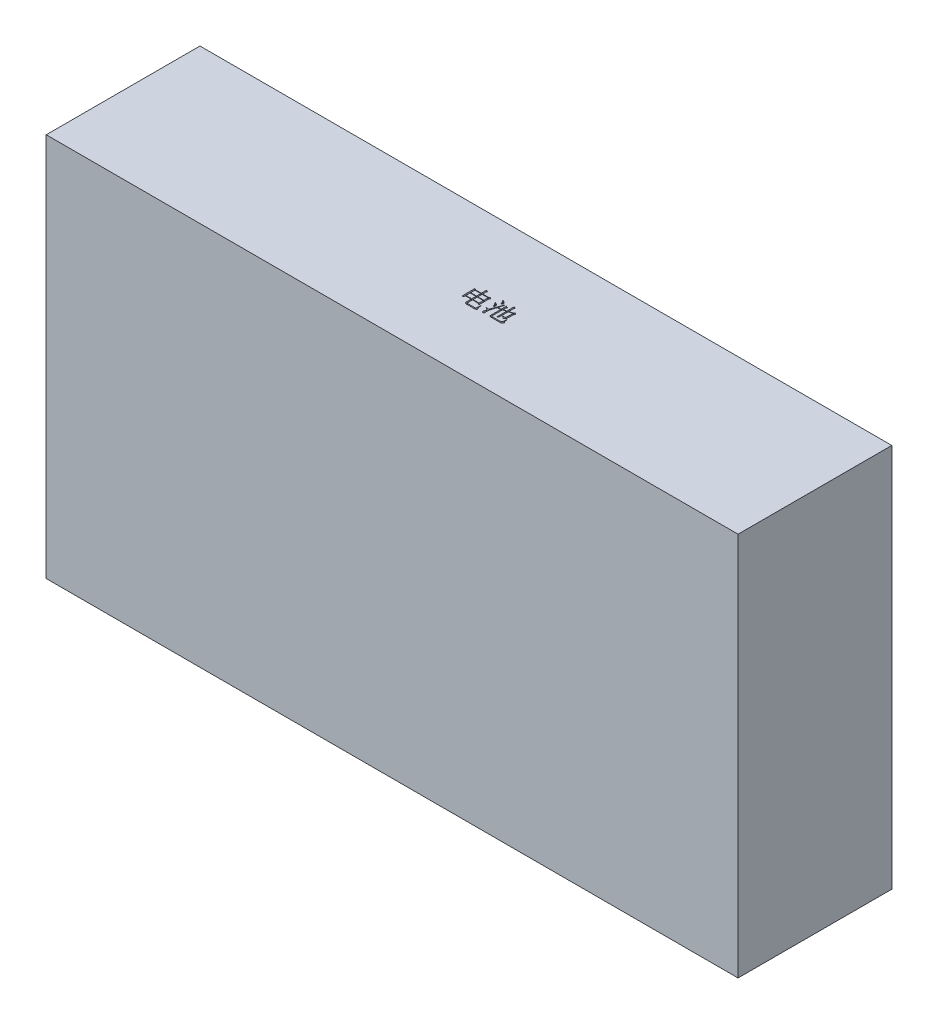
from build123d import *

# Parameters (mm, degrees)
SKETCH_1_W          = 135
SKETCH_1_H          = 75
EXTRUDE_1_DEPTH     = 30
SKETCH_2_W          = 1.135817308
SKETCH_2_H          = 0.828725962
SKETCH_2_W_2        = 1.173677885
CUT_EXTRUDE_1_DEPTH = 2
SKETCH_3_W          = 1.135817308
SKETCH_3_H          = 0.828725961
SKETCH_3_W_2        = 1.173677885
SKETCH_3_H_2        = 0.828725962
CUT_EXTRUDE_2_DEPTH = 2


with BuildPart() as part:
    # 草图1 → 凸台-拉伸1 (new body)
    with BuildSketch(Plane.XY):
        Rectangle(SKETCH_1_W, SKETCH_1_H)
    extrude(amount=EXTRUDE_1_DEPTH)

    # 草图2 → 切除-拉伸1 (cut)
    # profile 1 of 5: a face of its own
    with BuildSketch(Plane(origin=(0, 0, 0), x_dir=(-1, 0, 0), z_dir=(0, 0, -1))):
        with BuildLine():
            add(Edge.make_bspline(
                [(-1.518096579, -12.00005887), (-1.51839648, -11.910080093), (-1.518983063, -11.734088851), (-1.522662, -11.476069715), (-1.527771012, -11.229940253), (-1.533992651, -11.069896883), (-1.537026867, -10.991845729)],
                knots=[0, 0, 0, 0, 1.070688816, 2.094181113, 3.070555925, 4, 4, 4, 4], degree=3))
            Line((-1.537026867, -10.991845729), (-1.101630233, -11.200780024))
            Line((-1.101630233, -11.200780024), (-1.253072541, -11.333993165))
            Line((-1.253072541, -11.333993165), (-1.253072541, -12.00005887))
            Line((-1.253072541, -12.00005887), (-0.098324944, -12.00005887))
            Line((-0.098324944, -12.00005887), (0.09097794, -11.810755986))
            Line((0.09097794, -11.810755986), (0.356001979, -12.075780024))
            Line((0.356001979, -12.075780024), (0.185629383, -12.207590922))
            add(Edge.make_bspline(
                [(0.185629383, -12.207590922), (0.185648727, -12.269055892), (0.185686459, -12.388947641), (0.185418819, -12.564229137), (0.18635867, -12.730627775), (0.187004406, -12.888146551), (0.187694801, -13.036784555), (0.188474293, -13.176540829), (0.188898989, -13.307654935), (0.190526705, -13.430113938), (0.191876796, -13.543696055), (0.193259336, -13.648163825), (0.194745866, -13.743748333), (0.195860051, -13.830698919), (0.198144027, -13.908749475), (0.200217449, -13.977927681), (0.202279662, -14.038226668), (0.203838586, -14.075613868), (0.204559671, -14.092907428)],
                knots=[0, 0, 0, 0, 1.564731616, 3.052119083, 4.462174954, 5.800836896, 7.0621555, 8.246130873, 9.358712606, 10.399951826, 11.363852354, 12.25041514, 13.059641411, 13.79748155, 14.464070136, 15.047399153, 15.559371661, 16, 16, 16, 16], degree=3))
            Line((0.204559671, -14.092907428), (-0.079394656, -14.225419447))
            Line((-0.079394656, -14.225419447), (-0.079394656, -13.998255986))
            Line((-0.079394656, -13.998255986), (-1.253072541, -13.998255986))
            Line((-1.253072541, -13.998255986), (-1.253072541, -14.861336915))
            add(Edge.make_bspline(
                [(-1.253072541, -14.861336915), (-1.252464781, -14.877976301), (-1.251320635, -14.909301), (-1.241178206, -14.953307775), (-1.222084156, -14.98992959), (-1.197451788, -15.021395208), (-1.164087627, -15.044618517), (-1.124115458, -15.060909186), (-1.077302267, -15.070506817), (-1.043717894, -15.071727358), (-1.025909079, -15.072374575)],
                knots=[0, 0, 0, 0, 1.124103962, 2.116197056, 3.020287974, 3.895928428, 4.79003215, 5.731558757, 6.79711165, 8, 8, 8, 8], degree=3))
            Line((-1.025909079, -15.072374575), (0.280280825, -15.072374575))
            add(Edge.make_bspline(
                [(0.280280825, -15.072374575), (0.293717118, -15.070525707), (0.319710379, -15.066948967), (0.355471541, -15.053835763), (0.387380473, -15.037236078), (0.413716528, -15.014212803), (0.434996481, -14.986137644), (0.452168119, -14.953311636), (0.463782067, -14.915262305), (0.470397958, -14.871329778), (0.474846547, -14.819535416), (0.48006715, -14.757163679), (0.483624174, -14.683004748), (0.488928062, -14.597504339), (0.493604465, -14.500735356), (0.498816059, -14.392549057), (0.502510982, -14.272618552), (0.505748704, -14.188725116), (0.507444286, -14.144790441)],
                knots=[0, 0, 0, 0, 0.629422311, 1.217652751, 1.762775589, 2.294829829, 2.829987746, 3.394303386, 4.0100451, 4.671629752, 5.458421737, 6.429409418, 7.584151651, 8.913252979, 10.416123777, 12.092816459, 13.95382277, 16, 16, 16, 16], degree=3))
            Line((0.507444286, -14.144790441), (0.602095729, -14.144790441))
            add(Edge.make_bspline(
                [(0.602095729, -14.144790441), (0.602059878, -14.182656597), (0.601991477, -14.254901998), (0.606105707, -14.358190303), (0.610163764, -14.451323399), (0.618330455, -14.534260478), (0.626932994, -14.607331833), (0.638057053, -14.670550676), (0.650747867, -14.723975171), (0.671399828, -14.780989378), (0.703342799, -14.842369491), (0.749876219, -14.907452208), (0.803734922, -14.966663139), (0.845787304, -14.999119266), (0.867119767, -15.01558371)],
                knots=[0, 0, 0, 0, 1.432623561, 2.73332378, 3.91109551, 4.959115756, 5.885964426, 6.694330385, 7.387096859, 7.960541899, 8.984902095, 9.993374407, 10.982072752, 12, 12, 12, 12], degree=3))
            add(Edge.make_bspline(
                [(0.867119767, -15.01558371), (0.854367876, -15.03929637), (0.829739692, -15.085093476), (0.784835912, -15.145888343), (0.734473187, -15.195833018), (0.678402183, -15.235817856), (0.613265116, -15.265450339), (0.537577604, -15.28471715), (0.450621244, -15.2976005), (0.388774926, -15.298866939), (0.356001979, -15.299538037)],
                knots=[0, 0, 0, 0, 1.033786579, 1.996588944, 2.892065822, 3.749251075, 4.629327101, 5.624996779, 6.741463396, 8, 8, 8, 8], degree=3))
            Line((0.356001979, -15.299538037), (-1.120560521, -15.299538037))
            add(Edge.make_bspline(
                [(-1.120560521, -15.299538037), (-1.151732325, -15.298361407), (-1.210423792, -15.296146004), (-1.29279433, -15.278927441), (-1.36306229, -15.249084058), (-1.420258983, -15.205638404), (-1.465249991, -15.150540049), (-1.496967017, -15.083011936), (-1.514809153, -15.003403106), (-1.516958457, -14.946733706), (-1.518096579, -14.916725537)],
                knots=[0, 0, 0, 0, 1.182522994, 2.2264996, 3.175847754, 4.055853476, 4.925921917, 5.850408872, 6.861726179, 8, 8, 8, 8], degree=3))
            Line((-1.518096579, -14.916725537), (-1.518096579, -13.998255986))
            Line((-1.518096579, -13.998255986), (-2.653913887, -13.998255986))
            Line((-2.653913887, -13.998255986), (-2.653913887, -14.263280024))
            Line((-2.653913887, -14.263280024), (-2.937868214, -14.395792043))
            add(Edge.make_bspline(
                [(-2.937868214, -14.395792043), (-2.932567229, -14.178455719), (-2.92182957, -13.738219927), (-2.918047586, -13.187061219), (-2.919931588, -12.747212345), (-2.923481317, -12.428897495), (-2.928628177, -12.124582157), (-2.934836752, -11.926435397), (-2.937868214, -11.829686274)],
                knots=[0, 0, 0, 0, 1.524726016, 3.088480342, 3.86542604, 4.609627723, 5.321122896, 6, 6, 6, 6], degree=3))
            Line((-2.937868214, -11.829686274), (-2.634983598, -12.00005887))
            Line((-2.634983598, -12.00005887), (-1.518096579, -12.00005887))
        make_face()
        with Locations((-2.086005233, -12.528003582)):
            Rectangle(SKETCH_2_W, SKETCH_2_H, mode=Mode.SUBTRACT)
        with Locations((-0.666233599, -12.528003582)):
            Rectangle(SKETCH_2_W_2, SKETCH_2_H, mode=Mode.SUBTRACT)
        with Locations((-2.086005233, -13.470311274)):
            Rectangle(SKETCH_2_W, SKETCH_2_H, mode=Mode.SUBTRACT)
        with Locations((-0.666233599, -13.470311274)):
            Rectangle(SKETCH_2_W_2, SKETCH_2_H, mode=Mode.SUBTRACT)
    # profile 2 of 5: a face of its own
    with BuildSketch(Plane(origin=(0, 0, 0), x_dir=(-1, 0, 0), z_dir=(0, 0, -1))):
        with BuildLine():
            Line((3.990617363, -12.602322492), (3.365917844, -12.752362556))
            Line((3.365917844, -12.752362556), (3.365917844, -14.629966723))
            add(Edge.make_bspline(
                [(3.365917844, -14.629966723), (3.366286239, -14.650583705), (3.366977081, -14.689246238), (3.376400483, -14.743139062), (3.390126047, -14.789458544), (3.411890521, -14.8268035), (3.438367838, -14.85722321), (3.47213071, -14.878613181), (3.512142811, -14.890583803), (3.540415547, -14.892095688), (3.555220729, -14.892887396)],
                knots=[0, 0, 0, 0, 1.341381956, 2.515461521, 3.555606715, 4.469749405, 5.310702008, 6.159749455, 7.036342158, 8, 8, 8, 8], degree=3))
            Line((3.555220729, -14.892887396), (5.126434671, -14.892887396))
            add(Edge.make_bspline(
                [(5.126434671, -14.892887396), (5.142849761, -14.892262013), (5.174412817, -14.891059521), (5.219518965, -14.880525948), (5.259024016, -14.86224176), (5.293438162, -14.836917189), (5.321329727, -14.803901604), (5.345095171, -14.764593656), (5.362337227, -14.717687311), (5.373462595, -14.663713151), (5.38220211, -14.603461722), (5.389969971, -14.536823465), (5.395861844, -14.463836448), (5.402071849, -14.38442237), (5.404588711, -14.298327135), (5.40898133, -14.205826583), (5.409721578, -14.106695436), (5.410161509, -14.038452506), (5.410388998, -14.003163838)],
                knots=[0, 0, 0, 0, 0.7605698, 1.462429284, 2.131562217, 2.766653432, 3.427307041, 4.122440357, 4.887321986, 5.731339313, 6.673967508, 7.71042515, 8.841755492, 10.069477544, 11.403612001, 12.835210489, 14.363475806, 16, 16, 16, 16], degree=3))
            Line((5.410388998, -14.003163838), (5.50504044, -14.003163838))
            add(Edge.make_bspline(
                [(5.50504044, -14.003163838), (5.506832948, -14.037756804), (5.510261753, -14.103928107), (5.516384788, -14.198621728), (5.523883087, -14.28397889), (5.533113873, -14.359687471), (5.542615038, -14.425950999), (5.553636244, -14.482872416), (5.565996867, -14.53044431), (5.583517333, -14.581341723), (5.61238666, -14.636147181), (5.655894312, -14.695345371), (5.707890347, -14.750971066), (5.748994832, -14.78221877), (5.770064479, -14.798235954)],
                knots=[0, 0, 0, 0, 1.426525458, 2.728735367, 3.907704043, 4.954667923, 5.869362767, 6.664021964, 7.341038244, 7.89200131, 8.87776317, 9.876918957, 10.911735073, 12, 12, 12, 12], degree=3))
            add(Edge.make_bspline(
                [(5.770064479, -14.798235954), (5.756965551, -14.825021617), (5.731550843, -14.876991502), (5.683061774, -14.946670166), (5.625970037, -15.003847882), (5.563097529, -15.051522258), (5.491882592, -15.085790489), (5.414034705, -15.108918528), (5.329265469, -15.122086887), (5.270441776, -15.120744948), (5.240016402, -15.120050857)],
                knots=[0, 0, 0, 0, 1.075096548, 2.085916022, 3.046068131, 3.980541465, 4.919722121, 5.880207532, 6.903579907, 8, 8, 8, 8], degree=3))
            Line((5.240016402, -15.120050857), (3.479499575, -15.120050857))
            add(Edge.make_bspline(
                [(3.479499575, -15.120050857), (3.451340682, -15.118943016), (3.398096789, -15.116848269), (3.323377374, -15.098502635), (3.259220936, -15.067783178), (3.207229371, -15.02270441), (3.16692845, -14.965441824), (3.13930916, -14.895827004), (3.122461642, -14.814457768), (3.120739607, -14.756259929), (3.119824094, -14.725319287)],
                knots=[0, 0, 0, 0, 1.103584427, 2.086698913, 2.997196219, 3.868565132, 4.756616822, 5.718849767, 6.787235826, 8, 8, 8, 8], degree=3))
            Line((3.119824094, -14.725319287), (3.119824094, -12.809854543))
            Line((3.119824094, -12.809854543), (2.79800919, -12.884874575))
            Line((2.79800919, -12.884874575), (2.722288036, -12.959894607))
            Line((2.722288036, -12.959894607), (2.589776017, -12.828784832))
            Line((2.589776017, -12.828784832), (3.119824094, -12.715904223))
            add(Edge.make_bspline(
                [(3.119824094, -12.715904223), (3.119967872, -12.657476785), (3.120243357, -12.545527773), (3.118370047, -12.38520839), (3.11725181, -12.24007134), (3.115274214, -12.110355511), (3.112140675, -11.996086677), (3.109966143, -11.896951169), (3.105521049, -11.813068176), (3.102329176, -11.762142568), (3.100893806, -11.739241563)],
                knots=[0, 0, 0, 0, 1.435253637, 2.749996107, 3.938441586, 5.000668915, 5.936736011, 6.746544728, 7.436327089, 8, 8, 8, 8], degree=3))
            Line((3.100893806, -11.739241563), (3.498429863, -11.94537137))
            Line((3.498429863, -11.94537137), (3.365917844, -12.058251979))
            Line((3.365917844, -12.058251979), (3.365917844, -12.659113357))
            Line((3.365917844, -12.659113357), (3.990617363, -12.509073293))
            add(Edge.make_bspline(
                [(3.990617363, -12.509073293), (3.99059817, -12.463967845), (3.990560578, -12.375626605), (3.990828715, -12.246385066), (3.989885763, -12.12322262), (3.989241221, -12.006368873), (3.9885501, -11.895591393), (3.98777028, -11.790891426), (3.987347269, -11.692261217), (3.985722606, -11.599951578), (3.984359283, -11.513947006), (3.982970855, -11.434018476), (3.981509463, -11.360168774), (3.980374343, -11.292379411), (3.978070182, -11.23092522), (3.976022706, -11.175534669), (3.973951009, -11.126453632), (3.972406422, -11.095844594), (3.971687075, -11.081589319)],
                knots=[0, 0, 0, 0, 1.516438171, 2.970018801, 4.345049955, 5.657224643, 6.898685937, 8.069434, 9.177326018, 10.214594483, 11.173300777, 12.069158568, 12.902169219, 13.656623382, 14.348458002, 14.969623617, 15.520131973, 16, 16, 16, 16], degree=3))
            Line((3.971687075, -11.081589319), (4.388153421, -11.26948996))
            Line((4.388153421, -11.26948996), (4.236711113, -11.400599736))
            Line((4.236711113, -11.400599736), (4.236711113, -12.43335214))
            Line((4.236711113, -12.43335214), (4.956062075, -12.245451498))
            Line((4.956062075, -12.245451498), (5.107504383, -12.020391402))
            Line((5.107504383, -12.020391402), (5.391458709, -12.245451498))
            Line((5.391458709, -12.245451498), (5.25894669, -12.395491563))
            add(Edge.make_bspline(
                [(5.25894669, -12.395491563), (5.257307518, -12.468875581), (5.25418582, -12.608630725), (5.249783017, -12.8079788), (5.246854564, -12.986554868), (5.242194094, -13.14475305), (5.238720958, -13.282407594), (5.236091016, -13.399738617), (5.233342006, -13.496264417), (5.230508346, -13.574800516), (5.227375308, -13.640803751), (5.221220781, -13.699596226), (5.211881662, -13.753574846), (5.201344124, -13.803096188), (5.186081028, -13.847361452), (5.169743149, -13.887583502), (5.149912899, -13.923107297), (5.119271132, -13.964908855), (5.072471565, -14.012241028), (5.006584208, -14.064603113), (4.929579481, -14.115680382), (4.872474977, -14.145338212), (4.842480344, -14.160916242)],
                knots=[0, 0, 0, 0, 2.278191402, 4.338669061, 6.188688622, 7.821325301, 9.250741611, 10.462437636, 11.463852696, 12.247776932, 12.901606196, 13.514394572, 14.080824745, 14.601670495, 15.083365302, 15.531974723, 15.947650047, 16.342287706, 17.137440704, 18.004054335, 18.951612365, 20, 20, 20, 20], degree=3))
            add(Edge.make_bspline(
                [(4.842480344, -14.160916242), (4.832348839, -14.140901628), (4.811871049, -14.100448106), (4.769143293, -14.046008424), (4.720326644, -13.994436842), (4.662313397, -13.947767328), (4.596275193, -13.905067108), (4.521650515, -13.866839672), (4.439216192, -13.832109612), (4.380612668, -13.813614238), (4.350292844, -13.804045248)],
                knots=[0, 0, 0, 0, 0.857490565, 1.73315924, 2.638712329, 3.57422351, 4.577545369, 5.646778278, 6.782508935, 8, 8, 8, 8], degree=3))
            Line((4.350292844, -13.804045248), (4.350292844, -13.729025216))
            add(Edge.make_bspline(
                [(4.350292844, -13.729025216), (4.381823007, -13.733619933), (4.441781483, -13.742357352), (4.527441615, -13.752412029), (4.603799348, -13.761854193), (4.671115997, -13.768888925), (4.729314666, -13.773894027), (4.778174157, -13.776879436), (4.817953538, -13.777650605), (4.857597563, -13.776783988), (4.899530977, -13.766188985), (4.93893647, -13.733972221), (4.963845536, -13.684812444), (4.974168243, -13.639809399), (4.97719688, -13.601643157), (4.980519349, -13.572272626), (4.98186912, -13.53502376), (4.98533808, -13.489983653), (4.986963061, -13.437124187), (4.988978864, -13.376351717), (4.992191566, -13.307905476), (4.994005883, -13.231230181), (4.995884375, -13.146850419), (4.999257277, -13.054562958), (5.000694433, -12.954508062), (5.004100608, -12.846559993), (5.005877088, -12.730861683), (5.007799038, -12.607456924), (5.011070729, -12.476130693), (5.012246706, -12.385911297), (5.01285294, -12.339401819)],
                knots=[0, 0, 0, 0, 1.336413042, 2.541353534, 3.617425364, 4.563580778, 5.38009713, 6.067408733, 6.616450012, 7.048216175, 7.73089842, 8.386144333, 9.114521985, 10.001386096, 10.306690878, 10.720269174, 11.240646342, 11.869246219, 12.614835096, 13.458384009, 14.419852984, 15.488756895, 16.675253639, 17.960011834, 19.362112921, 20.872244914, 22.489965289, 24.215499161, 26.049031938, 28, 28, 28, 28], degree=3))
            Line((5.01285294, -12.339401819), (4.236711113, -12.52730246))
            Line((4.236711113, -12.52730246), (4.236711113, -13.729025216))
            add(Edge.make_bspline(
                [(4.236711113, -13.729025216), (4.23703512, -13.777171095), (4.237697364, -13.87557753), (4.241477867, -14.026792762), (4.246765677, -14.185049252), (4.252639794, -14.292969657), (4.255641402, -14.348115761)],
                knots=[0, 0, 0, 0, 0.9326831, 1.906331799, 2.930159278, 4, 4, 4, 4], degree=3))
            Line((4.255641402, -14.348115761), (3.971687075, -14.479926659))
            add(Edge.make_bspline(
                [(3.971687075, -14.479926659), (3.977119789, -14.343692999), (3.98785204, -14.07456527), (3.989703246, -13.805230604), (3.990617363, -13.672234351)],
                knots=[0, 0, 0, 0, 1.012408946, 2, 2, 2, 2], degree=3))
            Line((3.990617363, -13.672234351), (3.990617363, -12.602322492))
        make_face()
    # profile 3 of 5: a face of its own
    with BuildSketch(Plane(origin=(0, 0, 0), x_dir=(-1, 0, 0), z_dir=(0, 0, -1))):
        with BuildLine():
            add(Edge.make_bspline(
                [(2.79800919, -11.795331306), (2.773478943, -11.876664153), (2.72582756, -12.034657774), (2.656250842, -12.264809488), (2.591331512, -12.481074638), (2.530079619, -12.683388414), (2.473265144, -12.871983226), (2.420960058, -13.046880116), (2.372287479, -13.20781572), (2.328307828, -13.354874893), (2.288113518, -13.488252988), (2.252763184, -13.607798532), (2.220618059, -13.713189372), (2.194359181, -13.805286864), (2.171297543, -13.8832989), (2.152096705, -13.947489016), (2.13756155, -13.997790701), (2.116942866, -14.06762817), (2.095158814, -14.166972881), (2.076562198, -14.305067137), (2.066925579, -14.456166963), (2.067492017, -14.588649414), (2.071573629, -14.695640686), (2.074370503, -14.771129321), (2.076988492, -14.840091491), (2.080279342, -14.902517968), (2.085055497, -14.958302603), (2.088019932, -15.007690865), (2.092136038, -15.050732805), (2.095867515, -15.077059372), (2.097588517, -15.089201498)],
                knots=[0, 0, 0, 0, 2.099872221, 4.079119681, 5.943273429, 7.681271436, 9.304175454, 10.811986956, 12.193641282, 13.460202943, 14.606139685, 15.636986096, 16.541672997, 17.329641089, 18.004152826, 18.552500733, 18.98576718, 19.298413614, 20.35234309, 21.495305488, 22.739966369, 24.091757684, 24.768048226, 25.38660679, 25.958985128, 26.4739387, 26.931627051, 27.342801753, 27.696892348, 28, 28, 28, 28], degree=3))
            add(Edge.make_bspline(
                [(2.097588517, -15.089201498), (2.096873286, -15.100548889), (2.095515945, -15.122083579), (2.074574706, -15.148749239), (2.041741277, -15.162954107), (2.016880559, -15.164215297), (2.002937075, -15.164922652)],
                knots=[0, 0, 0, 0, 0.970945968, 1.84262797, 2.790007448, 4, 4, 4, 4], degree=3))
            add(Edge.make_bspline(
                [(2.002937075, -15.164922652), (1.989577166, -15.164580909), (1.96101774, -15.163850364), (1.916267995, -15.154818551), (1.86611115, -15.144110754), (1.814006997, -15.128265315), (1.762865494, -15.106566193), (1.726104024, -15.066317214), (1.702909748, -15.015250531), (1.701046751, -14.977067801), (1.700052459, -14.956689479)],
                knots=[0, 0, 0, 0, 0.773098138, 1.652648856, 2.638415398, 3.7437562, 4.81590307, 5.802785575, 6.827335235, 8, 8, 8, 8], degree=3))
            add(Edge.make_bspline(
                [(1.700052459, -14.956689479), (1.700889344, -14.938895531), (1.702761307, -14.899093582), (1.714117073, -14.833913118), (1.733016227, -14.757210015), (1.748484801, -14.702368854), (1.756843325, -14.672735152)],
                knots=[0, 0, 0, 0, 0.735604743, 1.64541913, 2.727690164, 4, 4, 4, 4], degree=3))
            add(Edge.make_bspline(
                [(1.756843325, -14.672735152), (1.76527935, -14.642887229), (1.781210752, -14.586519533), (1.799774324, -14.506181759), (1.811145603, -14.434912178), (1.812846275, -14.390449785), (1.81363419, -14.369850537)],
                knots=[0, 0, 0, 0, 1.204024663, 2.273796248, 3.200256724, 4, 4, 4, 4], degree=3))
            add(Edge.make_bspline(
                [(1.81363419, -14.369850537), (1.812482285, -14.348977342), (1.810260832, -14.308723338), (1.795326222, -14.251148466), (1.766727084, -14.201916605), (1.735161925, -14.165994574), (1.702555789, -14.141422397), (1.671956137, -14.12218645), (1.634845293, -14.10382593), (1.591855178, -14.084748477), (1.542656968, -14.065970773), (1.487206741, -14.047125187), (1.425473662, -14.028203067), (1.38201207, -14.016361315), (1.359307267, -14.010175056)],
                knots=[0, 0, 0, 0, 1.187079274, 2.289285076, 3.342195022, 4.395775184, 4.983000191, 5.657502931, 6.447674094, 7.333854754, 8.330539672, 9.439608888, 10.662424192, 12, 12, 12, 12], degree=3))
            Line((1.359307267, -14.010175056), (1.359307267, -13.934453902))
            add(Edge.make_bspline(
                [(1.359307267, -13.934453902), (1.386422725, -13.937204156), (1.437854432, -13.942420747), (1.510906611, -13.950671038), (1.576160844, -13.956061815), (1.633418318, -13.960357701), (1.682731326, -13.963225072), (1.723885307, -13.964802574), (1.757074577, -13.964742639), (1.792008305, -13.963917695), (1.833839465, -13.95013688), (1.87997823, -13.913612273), (1.928288963, -13.860496847), (1.964864233, -13.809092305), (1.992319336, -13.762545214), (2.01042901, -13.721875823), (2.034526713, -13.66882584), (2.062482245, -13.602242643), (2.093479223, -13.522141178), (2.130475821, -13.429426128), (2.170833695, -13.323285736), (2.214836164, -13.203624078), (2.264075616, -13.071258016), (2.317477976, -12.925548098), (2.373862366, -12.766079029), (2.435870965, -12.593797052), (2.501434344, -12.40811188), (2.572112722, -12.209506638), (2.645018113, -11.997121936), (2.696034593, -11.851393769), (2.722288036, -11.776401018)],
                knots=[0, 0, 0, 0, 0.806078407, 1.528942978, 2.174139014, 2.742443627, 3.227077505, 3.635123599, 3.959990669, 4.209208728, 4.666085266, 5.230170781, 5.929520146, 6.78686705, 7.090368904, 7.526322458, 8.101811569, 8.814290953, 9.661434987, 10.642071693, 11.766594832, 13.019739121, 14.412841836, 15.943517101, 17.609453901, 19.415342579, 21.358862449, 23.43350708, 25.650050269, 28, 28, 28, 28], degree=3))
            Line((2.722288036, -11.776401018), (2.79800919, -11.795331306))
        make_face()
    # profile 4 of 5: a face of its own
    with BuildSketch(Plane(origin=(0, 0, 0), x_dir=(-1, 0, 0), z_dir=(0, 0, -1))):
        with BuildLine():
            add(Edge.make_bspline(
                [(1.378237556, -12.160615761), (1.430110672, -12.186597058), (1.528021416, -12.235636875), (1.662851377, -12.311310795), (1.777547575, -12.382945849), (1.871580666, -12.451244987), (1.9450436, -12.516356593), (1.99823571, -12.577744656), (2.032527089, -12.636624984), (2.042836718, -12.693854855), (2.039726331, -12.74475704), (2.035565152, -12.791026349), (2.026748195, -12.8329244), (2.015962217, -12.870956716), (2.001231968, -12.904995357), (1.98286173, -12.934609019), (1.961646875, -12.96038651), (1.937974073, -12.981024576), (1.912902322, -12.995251493), (1.886293305, -12.999931845), (1.860305672, -12.990717251), (1.837259829, -12.970376779), (1.815470796, -12.940482985), (1.794647783, -12.900454671), (1.774668875, -12.849832522), (1.763099457, -12.812054008), (1.756843325, -12.791625377)],
                knots=[0, 0, 0, 0, 2.782636489, 5.252239056, 7.413831846, 9.265898059, 10.821636069, 12.110617316, 13.153870737, 14.044324011, 14.851802302, 15.595855226, 16.270825857, 16.902215511, 17.489572371, 18.04333773, 18.568685677, 19.085471199, 19.541814969, 19.938171372, 20.338785554, 20.81678546, 21.393017335, 22.105224683, 22.975405283, 24, 24, 24, 24], degree=3))
            add(Edge.make_bspline(
                [(1.756843325, -12.791625377), (1.74800681, -12.771393812), (1.729498703, -12.729018741), (1.694796988, -12.665418822), (1.652873593, -12.598583683), (1.604741855, -12.527970244), (1.549019588, -12.454072256), (1.485671345, -12.37747336), (1.416369432, -12.296285811), (1.366293942, -12.242460074), (1.340376979, -12.21460214)],
                knots=[0, 0, 0, 0, 0.740632677, 1.551257265, 2.42836451, 3.38773932, 4.41833746, 5.533066129, 6.723218966, 8, 8, 8, 8], degree=3))
            Line((1.340376979, -12.21460214), (1.378237556, -12.160615761))
        make_face()
    # profile 5 of 5: a face of its own
    with BuildSketch(Plane(origin=(0, 0, 0), x_dir=(-1, 0, 0), z_dir=(0, 0, -1))):
        with BuildLine():
            add(Edge.make_bspline(
                [(1.794703902, -11.081589319), (1.836435318, -11.101896222), (1.915489843, -11.140364905), (2.025104567, -11.198619141), (2.120454666, -11.251673216), (2.200546195, -11.301047677), (2.265442963, -11.346981188), (2.315054305, -11.389054724), (2.351175601, -11.426351184), (2.376709246, -11.470846778), (2.39172905, -11.519967085), (2.407041909, -11.569838311), (2.417180089, -11.610771309), (2.418737212, -11.635438568), (2.419403421, -11.645992364)],
                knots=[0, 0, 0, 0, 1.878989626, 3.559491816, 5.025500953, 6.296379828, 7.367815302, 8.24024707, 8.930256996, 9.456105514, 10.300157888, 11.000792397, 11.572492724, 12, 12, 12, 12], degree=3))
            add(Edge.make_bspline(
                [(2.419403421, -11.645992364), (2.418630793, -11.660819182), (2.417093391, -11.690322119), (2.403498242, -11.7329589), (2.383146583, -11.77401547), (2.354118981, -11.809554916), (2.324274802, -11.840341705), (2.296903367, -11.86351096), (2.272365999, -11.878907088), (2.256179364, -11.881726422), (2.249030825, -11.882971531)],
                knots=[0, 0, 0, 0, 1.143265861, 2.274911553, 3.430245753, 4.666104687, 5.803073093, 6.739861216, 7.443482172, 8, 8, 8, 8], degree=3))
            add(Edge.make_bspline(
                [(2.249030825, -11.882971531), (2.244245595, -11.882366912), (2.233988247, -11.881070886), (2.219334549, -11.871250799), (2.205114274, -11.856574931), (2.19079401, -11.836164116), (2.177297823, -11.810266616), (2.163175568, -11.778842258), (2.148371556, -11.742054524), (2.139923544, -11.715005992), (2.135449094, -11.700679864)],
                knots=[0, 0, 0, 0, 0.510822831, 1.094971087, 1.83877409, 2.700560191, 3.753946213, 4.964433001, 6.39222622, 8, 8, 8, 8], degree=3))
            add(Edge.make_bspline(
                [(2.135449094, -11.700679864), (2.126763334, -11.68049334), (2.108657902, -11.638414616), (2.076534691, -11.57473156), (2.037219061, -11.508837363), (1.993577589, -11.439316759), (1.942318717, -11.367959213), (1.886528358, -11.292732019), (1.823985314, -11.215137723), (1.779636669, -11.163048497), (1.756843325, -11.136276819)],
                knots=[0, 0, 0, 0, 0.77271414, 1.610719408, 2.505781945, 3.470187486, 4.496283323, 5.594276577, 6.763559043, 8, 8, 8, 8], degree=3))
            Line((1.756843325, -11.136276819), (1.794703902, -11.081589319))
        make_face()
    extrude(amount=-CUT_EXTRUDE_1_DEPTH, mode=Mode.SUBTRACT)

    # 草图3 → 切除-拉伸2 (cut)
    # profile 1 of 5: a face of its own
    with BuildSketch(Plane(origin=(0, 37.5, 0), x_dir=(1, 0, 0), z_dir=(0, 1, 0))):
        with BuildLine():
            add(Edge.make_bspline(
                [(1.73143245, -14.319495176), (1.731132549, -14.229516399), (1.730545966, -14.053525156), (1.726867029, -13.795506021), (1.721758017, -13.549376559), (1.715536377, -13.389333188), (1.712502161, -13.311282035)],
                knots=[0, 0, 0, 0, 1.070688816, 2.094181113, 3.070555925, 4, 4, 4, 4], degree=3))
            Line((1.712502161, -13.311282035), (2.147898796, -13.52021633))
            Line((2.147898796, -13.52021633), (1.996456488, -13.653429471))
            Line((1.996456488, -13.653429471), (1.996456488, -14.319495176))
            Line((1.996456488, -14.319495176), (3.151204085, -14.319495176))
            Line((3.151204085, -14.319495176), (3.340506969, -14.130192291))
            Line((3.340506969, -14.130192291), (3.605531008, -14.39521633))
            Line((3.605531008, -14.39521633), (3.435158411, -14.527027227))
            add(Edge.make_bspline(
                [(3.435158411, -14.527027227), (3.435177756, -14.588492198), (3.435215488, -14.708383947), (3.434947848, -14.883665443), (3.435887699, -15.05006408), (3.436533434, -15.207582857), (3.43722383, -15.356220861), (3.438003322, -15.495977135), (3.438428018, -15.62709124), (3.440055733, -15.749550244), (3.441405825, -15.86313236), (3.442788365, -15.967600131), (3.444274895, -16.063184639), (3.44538908, -16.150135225), (3.447673055, -16.22818578), (3.449746478, -16.297363987), (3.451808691, -16.357662974), (3.453367615, -16.395050174), (3.4540887, -16.412343734)],
                knots=[0, 0, 0, 0, 1.564731616, 3.052119083, 4.462174954, 5.800836896, 7.0621555, 8.246130873, 9.358712606, 10.399951826, 11.363852354, 12.25041514, 13.059641411, 13.79748155, 14.464070136, 15.047399153, 15.559371661, 16, 16, 16, 16], degree=3))
            Line((3.4540887, -16.412343734), (3.170134373, -16.544855753))
            Line((3.170134373, -16.544855753), (3.170134373, -16.317692291))
            Line((3.170134373, -16.317692291), (1.996456488, -16.317692291))
            Line((1.996456488, -16.317692291), (1.996456488, -17.180773221))
            add(Edge.make_bspline(
                [(1.996456488, -17.180773221), (1.997064248, -17.197412606), (1.998208394, -17.228737305), (2.008350823, -17.272744081), (2.027444873, -17.309365896), (2.052077241, -17.340831514), (2.085441401, -17.364054823), (2.125413571, -17.380345492), (2.172226762, -17.389943122), (2.205811135, -17.391163664), (2.22361995, -17.391810881)],
                knots=[0, 0, 0, 0, 1.124103962, 2.116197056, 3.020287974, 3.895928428, 4.79003215, 5.731558757, 6.79711165, 8, 8, 8, 8], degree=3))
            Line((2.22361995, -17.391810881), (3.529809854, -17.391810881))
            add(Edge.make_bspline(
                [(3.529809854, -17.391810881), (3.543246146, -17.389962012), (3.569239408, -17.386385272), (3.60500057, -17.373272068), (3.636909502, -17.356672384), (3.663245557, -17.333649109), (3.68452551, -17.30557395), (3.701697148, -17.272747941), (3.713311096, -17.234698611), (3.719926987, -17.190766084), (3.724375576, -17.138971722), (3.729596179, -17.076599985), (3.733153203, -17.002441054), (3.73845709, -16.916940644), (3.743133494, -16.820171662), (3.748345088, -16.711985362), (3.752040011, -16.592054857), (3.755277733, -16.508161421), (3.756973315, -16.464226746)],
                knots=[0, 0, 0, 0, 0.629422311, 1.217652751, 1.762775589, 2.294829829, 2.829987746, 3.394303386, 4.0100451, 4.671629752, 5.458421737, 6.429409418, 7.584151651, 8.913252979, 10.416123777, 12.092816459, 13.95382277, 16, 16, 16, 16], degree=3))
            Line((3.756973315, -16.464226746), (3.851624758, -16.464226746))
            add(Edge.make_bspline(
                [(3.851624758, -16.464226746), (3.851588907, -16.502092902), (3.851520506, -16.574338304), (3.855634736, -16.677626609), (3.859692793, -16.770759704), (3.867859484, -16.853696784), (3.876462022, -16.926768139), (3.887586082, -16.989986981), (3.900276896, -17.043411476), (3.920928857, -17.100425684), (3.952871828, -17.161805797), (3.999405248, -17.226888514), (4.053263951, -17.286099445), (4.095316333, -17.318555571), (4.116648796, -17.335020016)],
                knots=[0, 0, 0, 0, 1.432623561, 2.73332378, 3.91109551, 4.959115756, 5.885964426, 6.694330385, 7.387096859, 7.960541899, 8.984902095, 9.993374407, 10.982072752, 12, 12, 12, 12], degree=3))
            add(Edge.make_bspline(
                [(4.116648796, -17.335020016), (4.103896905, -17.358732675), (4.079268721, -17.404529782), (4.034364941, -17.465324649), (3.984002216, -17.515269324), (3.927931212, -17.555254161), (3.862794145, -17.584886644), (3.787106633, -17.604153456), (3.700150273, -17.617036805), (3.638303955, -17.618303245), (3.605531008, -17.618974343)],
                knots=[0, 0, 0, 0, 1.033786579, 1.996588944, 2.892065822, 3.749251075, 4.629327101, 5.624996779, 6.741463396, 8, 8, 8, 8], degree=3))
            Line((3.605531008, -17.618974343), (2.128968508, -17.618974343))
            add(Edge.make_bspline(
                [(2.128968508, -17.618974343), (2.097796704, -17.617797713), (2.039105237, -17.61558231), (1.956734699, -17.598363747), (1.886466739, -17.568520364), (1.829270045, -17.52507471), (1.784279038, -17.469976355), (1.752562012, -17.402448241), (1.734719876, -17.322839411), (1.732570572, -17.266170012), (1.73143245, -17.236161843)],
                knots=[0, 0, 0, 0, 1.182522994, 2.2264996, 3.175847754, 4.055853476, 4.925921917, 5.850408872, 6.861726179, 8, 8, 8, 8], degree=3))
            Line((1.73143245, -17.236161843), (1.73143245, -16.317692291))
            Line((1.73143245, -16.317692291), (0.595615142, -16.317692291))
            Line((0.595615142, -16.317692291), (0.595615142, -16.58271633))
            Line((0.595615142, -16.58271633), (0.311660815, -16.715228349))
            add(Edge.make_bspline(
                [(0.311660815, -16.715228349), (0.3169618, -16.497892025), (0.327699459, -16.057656233), (0.331481443, -15.506497525), (0.32959744, -15.066648651), (0.326047712, -14.748333801), (0.320900852, -14.444018462), (0.314692277, -14.245871703), (0.311660815, -14.14912258)],
                knots=[0, 0, 0, 0, 1.524726016, 3.088480342, 3.86542604, 4.609627723, 5.321122896, 6, 6, 6, 6], degree=3))
            Line((0.311660815, -14.14912258), (0.614545431, -14.319495176))
            Line((0.614545431, -14.319495176), (1.73143245, -14.319495176))
        make_face()
        with Locations((1.163523796, -14.847439888)):
            Rectangle(SKETCH_3_W, SKETCH_3_H, mode=Mode.SUBTRACT)
        with Locations((2.583295431, -14.847439888)):
            Rectangle(SKETCH_3_W_2, SKETCH_3_H, mode=Mode.SUBTRACT)
        with Locations((1.163523796, -15.78974758)):
            Rectangle(SKETCH_3_W, SKETCH_3_H_2, mode=Mode.SUBTRACT)
        with Locations((2.583295431, -15.78974758)):
            Rectangle(SKETCH_3_W_2, SKETCH_3_H_2, mode=Mode.SUBTRACT)
    # profile 2 of 5: a face of its own
    with BuildSketch(Plane(origin=(0, 37.5, 0), x_dir=(1, 0, 0), z_dir=(0, 1, 0))):
        with BuildLine():
            Line((7.240146392, -14.921758798), (6.615446873, -15.071798862))
            Line((6.615446873, -15.071798862), (6.615446873, -16.949403028))
            add(Edge.make_bspline(
                [(6.615446873, -16.949403028), (6.615815268, -16.97002001), (6.61650611, -17.008682544), (6.625929512, -17.062575368), (6.639655076, -17.10889485), (6.66141955, -17.146239806), (6.687896867, -17.176659515), (6.721659738, -17.198049487), (6.76167184, -17.210020109), (6.789944576, -17.211531994), (6.804749758, -17.212323702)],
                knots=[0, 0, 0, 0, 1.341381956, 2.515461521, 3.555606715, 4.469749405, 5.310702008, 6.159749455, 7.036342158, 8, 8, 8, 8], degree=3))
            Line((6.804749758, -17.212323702), (8.3759637, -17.212323702))
            add(Edge.make_bspline(
                [(8.3759637, -17.212323702), (8.39237879, -17.211698318), (8.423941846, -17.210495826), (8.469047994, -17.199962254), (8.508553045, -17.181678066), (8.542967191, -17.156353495), (8.570858755, -17.12333791), (8.594624199, -17.084029961), (8.611866256, -17.037123616), (8.622991624, -16.983149457), (8.631731139, -16.922898028), (8.639499, -16.85625977), (8.645390873, -16.783272753), (8.651600878, -16.703858676), (8.65411774, -16.617763441), (8.658510358, -16.525262889), (8.659250607, -16.426131742), (8.659690537, -16.357888812), (8.659918027, -16.322600144)],
                knots=[0, 0, 0, 0, 0.7605698, 1.462429284, 2.131562217, 2.766653432, 3.427307041, 4.122440357, 4.887321986, 5.731339313, 6.673967508, 7.71042515, 8.841755492, 10.069477544, 11.403612001, 12.835210489, 14.363475806, 16, 16, 16, 16], degree=3))
            Line((8.659918027, -16.322600144), (8.754569469, -16.322600144))
            add(Edge.make_bspline(
                [(8.754569469, -16.322600144), (8.756361976, -16.357193109), (8.759790782, -16.423364413), (8.765913816, -16.518058034), (8.773412116, -16.603415196), (8.782642902, -16.679123777), (8.792144067, -16.745387305), (8.803165273, -16.802308721), (8.815525896, -16.849880616), (8.833046362, -16.900778028), (8.861915689, -16.955583487), (8.90542334, -17.014781676), (8.957419376, -17.070407372), (8.99852386, -17.101655075), (9.019593508, -17.117672259)],
                knots=[0, 0, 0, 0, 1.426525458, 2.728735367, 3.907704043, 4.954667923, 5.869362767, 6.664021964, 7.341038244, 7.89200131, 8.87776317, 9.876918957, 10.911735073, 12, 12, 12, 12], degree=3))
            add(Edge.make_bspline(
                [(9.019593508, -17.117672259), (9.006494579, -17.144457923), (8.981079872, -17.196427808), (8.932590802, -17.266106472), (8.875499066, -17.323284188), (8.812626558, -17.370958564), (8.741411621, -17.405226794), (8.663563733, -17.428354833), (8.578794497, -17.441523192), (8.519970805, -17.440181254), (8.489545431, -17.439487163)],
                knots=[0, 0, 0, 0, 1.075096548, 2.085916022, 3.046068131, 3.980541465, 4.919722121, 5.880207532, 6.903579907, 8, 8, 8, 8], degree=3))
            Line((8.489545431, -17.439487163), (6.729028604, -17.439487163))
            add(Edge.make_bspline(
                [(6.729028604, -17.439487163), (6.700869711, -17.438379322), (6.647625818, -17.436284574), (6.572906403, -17.41793894), (6.508749965, -17.387219483), (6.4567584, -17.342140715), (6.416457479, -17.28487813), (6.388838189, -17.215263309), (6.37199067, -17.133894074), (6.370268636, -17.075696235), (6.369353123, -17.044755593)],
                knots=[0, 0, 0, 0, 1.103584427, 2.086698913, 2.997196219, 3.868565132, 4.756616822, 5.718849767, 6.787235826, 8, 8, 8, 8], degree=3))
            Line((6.369353123, -17.044755593), (6.369353123, -15.129290849))
            Line((6.369353123, -15.129290849), (6.047538219, -15.204310881))
            Line((6.047538219, -15.204310881), (5.971817065, -15.279330913))
            Line((5.971817065, -15.279330913), (5.839305046, -15.148221137))
            Line((5.839305046, -15.148221137), (6.369353123, -15.035340528))
            add(Edge.make_bspline(
                [(6.369353123, -15.035340528), (6.369496901, -14.976913091), (6.369772386, -14.864964078), (6.367899076, -14.704644696), (6.366780839, -14.559507645), (6.364803242, -14.429791816), (6.361669703, -14.315522982), (6.359495172, -14.216387474), (6.355050078, -14.132504481), (6.351858205, -14.081578873), (6.350422835, -14.058677868)],
                knots=[0, 0, 0, 0, 1.435253637, 2.749996107, 3.938441586, 5.000668915, 5.936736011, 6.746544728, 7.436327089, 8, 8, 8, 8], degree=3))
            Line((6.350422835, -14.058677868), (6.747958892, -14.264807676))
            Line((6.747958892, -14.264807676), (6.615446873, -14.377688285))
            Line((6.615446873, -14.377688285), (6.615446873, -14.978549663))
            Line((6.615446873, -14.978549663), (7.240146392, -14.828509599))
            add(Edge.make_bspline(
                [(7.240146392, -14.828509599), (7.240127199, -14.783404151), (7.240089607, -14.69506291), (7.240357744, -14.565821371), (7.239414792, -14.442658926), (7.23877025, -14.325805178), (7.238079129, -14.215027699), (7.237299309, -14.110327732), (7.236876298, -14.011697523), (7.235251635, -13.919387884), (7.233888312, -13.833383311), (7.232499884, -13.753454781), (7.231038492, -13.679605079), (7.229903372, -13.611815716), (7.227599211, -13.550361526), (7.225551734, -13.494970975), (7.223480038, -13.445889938), (7.221935451, -13.4152809), (7.221216104, -13.401025625)],
                knots=[0, 0, 0, 0, 1.516438171, 2.970018801, 4.345049955, 5.657224643, 6.898685937, 8.069434, 9.177326018, 10.214594483, 11.173300777, 12.069158568, 12.902169219, 13.656623382, 14.348458002, 14.969623617, 15.520131973, 16, 16, 16, 16], degree=3))
            Line((7.221216104, -13.401025625), (7.63768245, -13.588926266))
            Line((7.63768245, -13.588926266), (7.486240142, -13.720036041))
            Line((7.486240142, -13.720036041), (7.486240142, -14.752788445))
            Line((7.486240142, -14.752788445), (8.205591104, -14.564887804))
            Line((8.205591104, -14.564887804), (8.357033411, -14.339827708))
            Line((8.357033411, -14.339827708), (8.640987738, -14.564887804))
            Line((8.640987738, -14.564887804), (8.508475719, -14.714927868))
            add(Edge.make_bspline(
                [(8.508475719, -14.714927868), (8.506836547, -14.788311886), (8.503714849, -14.928067031), (8.499312046, -15.127415105), (8.496383592, -15.305991173), (8.491723123, -15.464189355), (8.488249986, -15.6018439), (8.485620045, -15.719174923), (8.482871035, -15.815700723), (8.480037375, -15.894236822), (8.476904337, -15.960240057), (8.47074981, -16.019032532), (8.46141069, -16.073011152), (8.450873153, -16.122532493), (8.435610057, -16.166797758), (8.419272178, -16.207019808), (8.399441928, -16.242543603), (8.368800161, -16.284345161), (8.322000594, -16.331677334), (8.256113237, -16.384039418), (8.17910851, -16.435116688), (8.122004005, -16.464774517), (8.092009373, -16.480352548)],
                knots=[0, 0, 0, 0, 2.278191402, 4.338669061, 6.188688622, 7.821325301, 9.250741611, 10.462437636, 11.463852696, 12.247776932, 12.901606196, 13.514394572, 14.080824745, 14.601670495, 15.083365302, 15.531974723, 15.947650047, 16.342287706, 17.137440704, 18.004054335, 18.951612365, 20, 20, 20, 20], degree=3))
            add(Edge.make_bspline(
                [(8.092009373, -16.480352548), (8.081877868, -16.460337934), (8.061400078, -16.419884412), (8.018672322, -16.36544473), (7.969855673, -16.313873148), (7.911842426, -16.267203634), (7.845804221, -16.224503414), (7.771179544, -16.186275977), (7.688745221, -16.151545918), (7.630141696, -16.133050543), (7.599821873, -16.123481554)],
                knots=[0, 0, 0, 0, 0.857490565, 1.73315924, 2.638712329, 3.57422351, 4.577545369, 5.646778278, 6.782508935, 8, 8, 8, 8], degree=3))
            Line((7.599821873, -16.123481554), (7.599821873, -16.048461522))
            add(Edge.make_bspline(
                [(7.599821873, -16.048461522), (7.631352035, -16.053056239), (7.691310512, -16.061793658), (7.776970643, -16.071848335), (7.853328376, -16.081290498), (7.920645026, -16.088325231), (7.978843694, -16.093330332), (8.027703186, -16.096315742), (8.067482567, -16.09708691), (8.107126592, -16.096220294), (8.149060006, -16.08562529), (8.188465499, -16.053408527), (8.213374565, -16.00424875), (8.223697272, -15.959245705), (8.226725909, -15.921079462), (8.230048378, -15.891708932), (8.231398149, -15.854460065), (8.234867108, -15.809419959), (8.23649209, -15.756560493), (8.238507893, -15.695788023), (8.241720594, -15.627341782), (8.243534912, -15.550666486), (8.245413403, -15.466286724), (8.248786306, -15.373999264), (8.250223462, -15.273944368), (8.253629637, -15.165996298), (8.255406117, -15.050297989), (8.257328066, -14.92689323), (8.260599758, -14.795566999), (8.261775735, -14.705347603), (8.262381969, -14.658838125)],
                knots=[0, 0, 0, 0, 1.336413042, 2.541353534, 3.617425364, 4.563580778, 5.38009713, 6.067408733, 6.616450012, 7.048216175, 7.73089842, 8.386144333, 9.114521985, 10.001386096, 10.306690878, 10.720269174, 11.240646342, 11.869246219, 12.614835096, 13.458384009, 14.419852984, 15.488756895, 16.675253639, 17.960011834, 19.362112921, 20.872244914, 22.489965289, 24.215499161, 26.049031938, 28, 28, 28, 28], degree=3))
            Line((8.262381969, -14.658838125), (7.486240142, -14.846738766))
            Line((7.486240142, -14.846738766), (7.486240142, -16.048461522))
            add(Edge.make_bspline(
                [(7.486240142, -16.048461522), (7.486564149, -16.0966074), (7.487226393, -16.195013836), (7.491006896, -16.346229068), (7.496294706, -16.504485557), (7.502168823, -16.612405963), (7.505170431, -16.667552067)],
                knots=[0, 0, 0, 0, 0.9326831, 1.906331799, 2.930159278, 4, 4, 4, 4], degree=3))
            Line((7.505170431, -16.667552067), (7.221216104, -16.799362964))
            add(Edge.make_bspline(
                [(7.221216104, -16.799362964), (7.226648818, -16.663129304), (7.237381069, -16.394001576), (7.239232275, -16.12466691), (7.240146392, -15.991670657)],
                knots=[0, 0, 0, 0, 1.012408946, 2, 2, 2, 2], degree=3))
            Line((7.240146392, -15.991670657), (7.240146392, -14.921758798))
        make_face()
    # profile 3 of 5: a face of its own
    with BuildSketch(Plane(origin=(0, 37.5, 0), x_dir=(1, 0, 0), z_dir=(0, 1, 0))):
        with BuildLine():
            add(Edge.make_bspline(
                [(6.047538219, -14.114767612), (6.023007972, -14.196100459), (5.975356589, -14.35409408), (5.905779871, -14.584245793), (5.840860541, -14.800510943), (5.779608648, -15.00282472), (5.722794173, -15.191419532), (5.670489087, -15.366316421), (5.621816508, -15.527252025), (5.577836857, -15.674311198), (5.537642547, -15.807689293), (5.502292213, -15.927234837), (5.470147088, -16.032625677), (5.44388821, -16.12472317), (5.420826572, -16.202735206), (5.401625734, -16.266925322), (5.387090579, -16.317227006), (5.366471895, -16.387064475), (5.344687843, -16.486409187), (5.326091226, -16.624503443), (5.316454608, -16.775603268), (5.317021046, -16.908085719), (5.321102658, -17.015076992), (5.323899532, -17.090565626), (5.326517521, -17.159527796), (5.329808371, -17.221954273), (5.334584525, -17.277738909), (5.337548961, -17.327127171), (5.341665066, -17.370169111), (5.345396544, -17.396495678), (5.347117546, -17.408637804)],
                knots=[0, 0, 0, 0, 2.099872221, 4.079119681, 5.943273429, 7.681271436, 9.304175454, 10.811986956, 12.193641282, 13.460202943, 14.606139685, 15.636986096, 16.541672997, 17.329641089, 18.004152826, 18.552500733, 18.98576718, 19.298413614, 20.35234309, 21.495305488, 22.739966369, 24.091757684, 24.768048226, 25.38660679, 25.958985128, 26.4739387, 26.931627051, 27.342801753, 27.696892348, 28, 28, 28, 28], degree=3))
            add(Edge.make_bspline(
                [(5.347117546, -17.408637804), (5.346402315, -17.419985195), (5.345044973, -17.441519885), (5.324103735, -17.468185544), (5.291270305, -17.482390413), (5.266409588, -17.483651602), (5.252466104, -17.484358958)],
                knots=[0, 0, 0, 0, 0.970945968, 1.84262797, 2.790007448, 4, 4, 4, 4], degree=3))
            add(Edge.make_bspline(
                [(5.252466104, -17.484358958), (5.239106194, -17.484017214), (5.210546769, -17.48328667), (5.165797024, -17.474254856), (5.115640179, -17.463547059), (5.063536026, -17.447701621), (5.012394523, -17.426002499), (4.975633053, -17.385753519), (4.952438776, -17.334686836), (4.95057578, -17.296504106), (4.949581488, -17.276125785)],
                knots=[0, 0, 0, 0, 0.773098138, 1.652648856, 2.638415398, 3.7437562, 4.81590307, 5.802785575, 6.827335235, 8, 8, 8, 8], degree=3))
            add(Edge.make_bspline(
                [(4.949581488, -17.276125785), (4.950418372, -17.258331837), (4.952290336, -17.218529887), (4.963646101, -17.153349424), (4.982545256, -17.07664632), (4.99801383, -17.02180516), (5.006372354, -16.992171458)],
                knots=[0, 0, 0, 0, 0.735604743, 1.64541913, 2.727690164, 4, 4, 4, 4], degree=3))
            add(Edge.make_bspline(
                [(5.006372354, -16.992171458), (5.014808379, -16.962323535), (5.030739781, -16.905955838), (5.049303353, -16.825618065), (5.060674632, -16.754348483), (5.062375304, -16.709886091), (5.063163219, -16.689286843)],
                knots=[0, 0, 0, 0, 1.204024663, 2.273796248, 3.200256724, 4, 4, 4, 4], degree=3))
            add(Edge.make_bspline(
                [(5.063163219, -16.689286843), (5.062011314, -16.668413648), (5.059789861, -16.628159644), (5.044855251, -16.570584772), (5.016256113, -16.521352911), (4.984690954, -16.48543088), (4.952084818, -16.460858702), (4.921485166, -16.441622756), (4.884374322, -16.423262235), (4.841384207, -16.404184783), (4.792185997, -16.385407079), (4.73673577, -16.366561492), (4.675002691, -16.347639373), (4.631541099, -16.33579762), (4.608836296, -16.329611362)],
                knots=[0, 0, 0, 0, 1.187079274, 2.289285076, 3.342195022, 4.395775184, 4.983000191, 5.657502931, 6.447674094, 7.333854754, 8.330539672, 9.439608888, 10.662424192, 12, 12, 12, 12], degree=3))
            Line((4.608836296, -16.329611362), (4.608836296, -16.253890208))
            add(Edge.make_bspline(
                [(4.608836296, -16.253890208), (4.635951754, -16.256640462), (4.687383461, -16.261857053), (4.760435639, -16.270107344), (4.825689873, -16.275498121), (4.882947347, -16.279794006), (4.932260355, -16.282661378), (4.973414336, -16.284238879), (5.006603605, -16.284178944), (5.041537334, -16.283354001), (5.083368494, -16.269573186), (5.129507259, -16.233048579), (5.177817992, -16.179933153), (5.214393262, -16.128528611), (5.241848365, -16.08198152), (5.259958039, -16.041312128), (5.284055742, -15.988262146), (5.312011274, -15.921678948), (5.343008252, -15.841577484), (5.38000485, -15.748862434), (5.420362724, -15.642722042), (5.464365192, -15.523060383), (5.513604645, -15.390694322), (5.567007005, -15.244984404), (5.623391395, -15.085515335), (5.685399994, -14.913233358), (5.750963373, -14.727548185), (5.821641751, -14.528942944), (5.894547142, -14.316558242), (5.945563622, -14.170830075), (5.971817065, -14.095837323)],
                knots=[0, 0, 0, 0, 0.806078407, 1.528942978, 2.174139014, 2.742443627, 3.227077505, 3.635123599, 3.959990669, 4.209208728, 4.666085266, 5.230170781, 5.929520146, 6.78686705, 7.090368904, 7.526322458, 8.101811569, 8.814290953, 9.661434987, 10.642071693, 11.766594832, 13.019739121, 14.412841836, 15.943517101, 17.609453901, 19.415342579, 21.358862449, 23.43350708, 25.650050269, 28, 28, 28, 28], degree=3))
            Line((5.971817065, -14.095837323), (6.047538219, -14.114767612))
        make_face()
    # profile 4 of 5: a face of its own
    with BuildSketch(Plane(origin=(0, 37.5, 0), x_dir=(1, 0, 0), z_dir=(0, 1, 0))):
        with BuildLine():
            add(Edge.make_bspline(
                [(4.627766585, -14.480052067), (4.679639701, -14.506033364), (4.777550445, -14.555073181), (4.912380406, -14.6307471), (5.027076604, -14.702382155), (5.121109695, -14.770681292), (5.194572629, -14.835792899), (5.247764739, -14.897180961), (5.282056118, -14.95606129), (5.292365747, -15.01329116), (5.289255359, -15.064193345), (5.285094181, -15.110462654), (5.276277224, -15.152360705), (5.265491246, -15.190393022), (5.250760997, -15.224431663), (5.232390759, -15.254045325), (5.211175904, -15.279822816), (5.187503102, -15.300460882), (5.16243135, -15.314687798), (5.135822334, -15.31936815), (5.1098347, -15.310153557), (5.086788858, -15.289813085), (5.064999825, -15.259919291), (5.044176812, -15.219890977), (5.024197903, -15.169268827), (5.012628486, -15.131490313), (5.006372354, -15.111061682)],
                knots=[0, 0, 0, 0, 2.782636489, 5.252239056, 7.413831846, 9.265898059, 10.821636069, 12.110617316, 13.153870737, 14.044324011, 14.851802302, 15.595855226, 16.270825857, 16.902215511, 17.489572371, 18.04333773, 18.568685677, 19.085471199, 19.541814969, 19.938171372, 20.338785554, 20.81678546, 21.393017335, 22.105224683, 22.975405283, 24, 24, 24, 24], degree=3))
            add(Edge.make_bspline(
                [(5.006372354, -15.111061682), (4.997535839, -15.090830117), (4.979027732, -15.048455046), (4.944326016, -14.984855128), (4.902402622, -14.918019989), (4.854270884, -14.84740655), (4.798548617, -14.773508562), (4.735200374, -14.696909666), (4.665898461, -14.615722117), (4.615822971, -14.561896379), (4.589906008, -14.534038445)],
                knots=[0, 0, 0, 0, 0.740632677, 1.551257265, 2.42836451, 3.38773932, 4.41833746, 5.533066129, 6.723218966, 8, 8, 8, 8], degree=3))
            Line((4.589906008, -14.534038445), (4.627766585, -14.480052067))
        make_face()
    # profile 5 of 5: a face of its own
    with BuildSketch(Plane(origin=(0, 37.5, 0), x_dir=(1, 0, 0), z_dir=(0, 1, 0))):
        with BuildLine():
            add(Edge.make_bspline(
                [(5.044232931, -13.401025625), (5.085964347, -13.421332528), (5.165018872, -13.45980121), (5.274633596, -13.518055447), (5.369983695, -13.571109521), (5.450075224, -13.620483983), (5.514971992, -13.666417494), (5.564583334, -13.70849103), (5.60070463, -13.745787489), (5.626238275, -13.790283084), (5.641258079, -13.839403391), (5.656570938, -13.889274617), (5.666709117, -13.930207615), (5.668266241, -13.954874874), (5.66893245, -13.96542867)],
                knots=[0, 0, 0, 0, 1.878989626, 3.559491816, 5.025500953, 6.296379828, 7.367815302, 8.24024707, 8.930256996, 9.456105514, 10.300157888, 11.000792397, 11.572492724, 12, 12, 12, 12], degree=3))
            add(Edge.make_bspline(
                [(5.66893245, -13.96542867), (5.668159822, -13.980255488), (5.666622419, -14.009758424), (5.653027271, -14.052395206), (5.632675612, -14.093451775), (5.60364801, -14.128991222), (5.573803831, -14.159778011), (5.546432396, -14.182947266), (5.521895028, -14.198343393), (5.505708393, -14.201162728), (5.498559854, -14.202407836)],
                knots=[0, 0, 0, 0, 1.143265861, 2.274911553, 3.430245753, 4.666104687, 5.803073093, 6.739861216, 7.443482172, 8, 8, 8, 8], degree=3))
            add(Edge.make_bspline(
                [(5.498559854, -14.202407836), (5.493774624, -14.201803218), (5.483517275, -14.200507192), (5.468863578, -14.190687104), (5.454643303, -14.176011237), (5.440323038, -14.155600422), (5.426826852, -14.129702922), (5.412704597, -14.098278564), (5.397900585, -14.061490829), (5.389452573, -14.034442297), (5.384978123, -14.02011617)],
                knots=[0, 0, 0, 0, 0.510822831, 1.094971087, 1.83877409, 2.700560191, 3.753946213, 4.964433001, 6.39222622, 8, 8, 8, 8], degree=3))
            add(Edge.make_bspline(
                [(5.384978123, -14.02011617), (5.376292363, -13.999929646), (5.358186931, -13.957850922), (5.32606372, -13.894167866), (5.28674809, -13.828273669), (5.243106618, -13.758753065), (5.191847746, -13.687395518), (5.136057387, -13.612168324), (5.073514343, -13.534574029), (5.029165698, -13.482484803), (5.006372354, -13.455713125)],
                knots=[0, 0, 0, 0, 0.77271414, 1.610719408, 2.505781945, 3.470187486, 4.496283323, 5.594276577, 6.763559043, 8, 8, 8, 8], degree=3))
            Line((5.006372354, -13.455713125), (5.044232931, -13.401025625))
        make_face()
    extrude(amount=-CUT_EXTRUDE_2_DEPTH, mode=Mode.SUBTRACT)


solid = part.part
